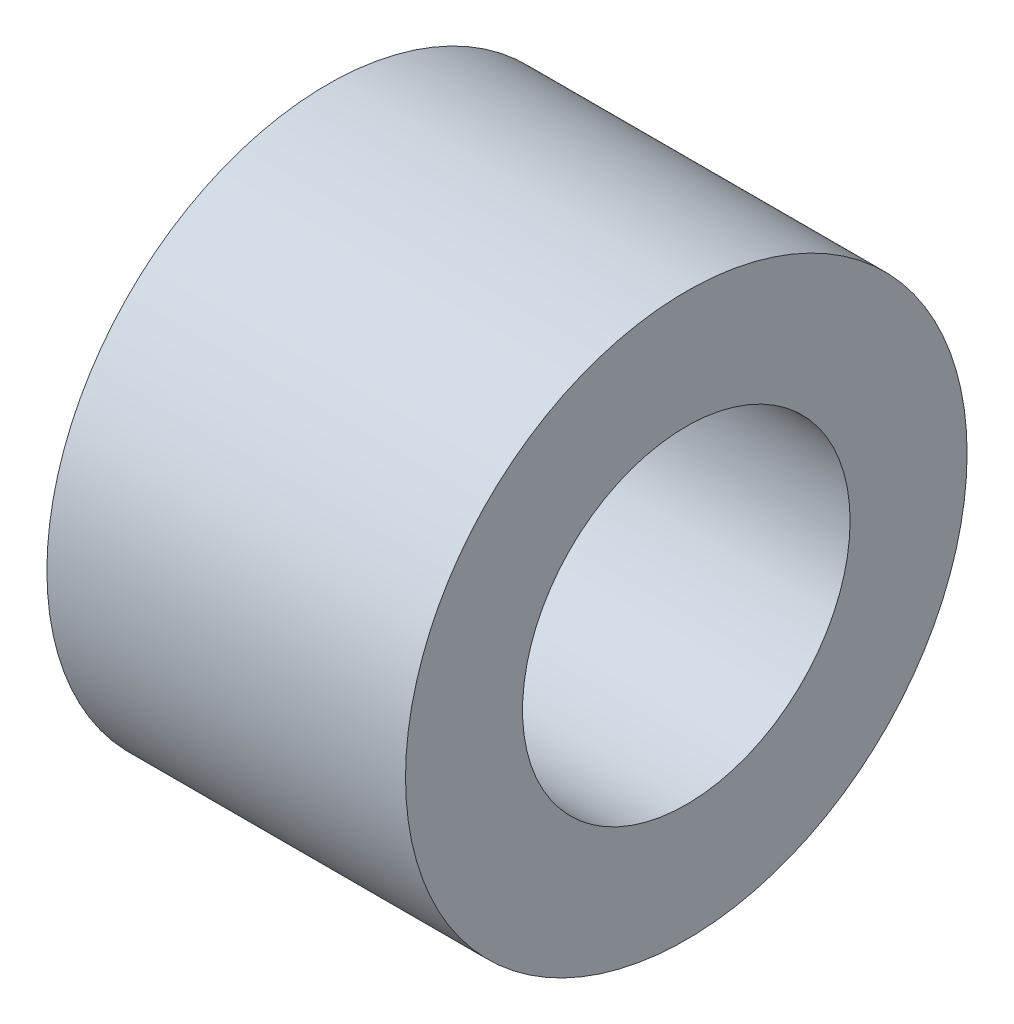
from build123d import *

# Parameters (mm, degrees)
SKETCH1_R           = 6
SKETCH1_R_2         = 3.5
BOSS_EXTRUDE1_DEPTH = 7.663296863


with BuildPart() as part:
    # Sketch1 → Boss-Extrude1 (new body)
    with BuildSketch(Plane(origin=(0, 0, 0), x_dir=(0, 0, -1), z_dir=(1, 0, 0))):
        Circle(SKETCH1_R)
        Circle(SKETCH1_R_2, mode=Mode.SUBTRACT)
    extrude(amount=BOSS_EXTRUDE1_DEPTH)


solid = part.part
